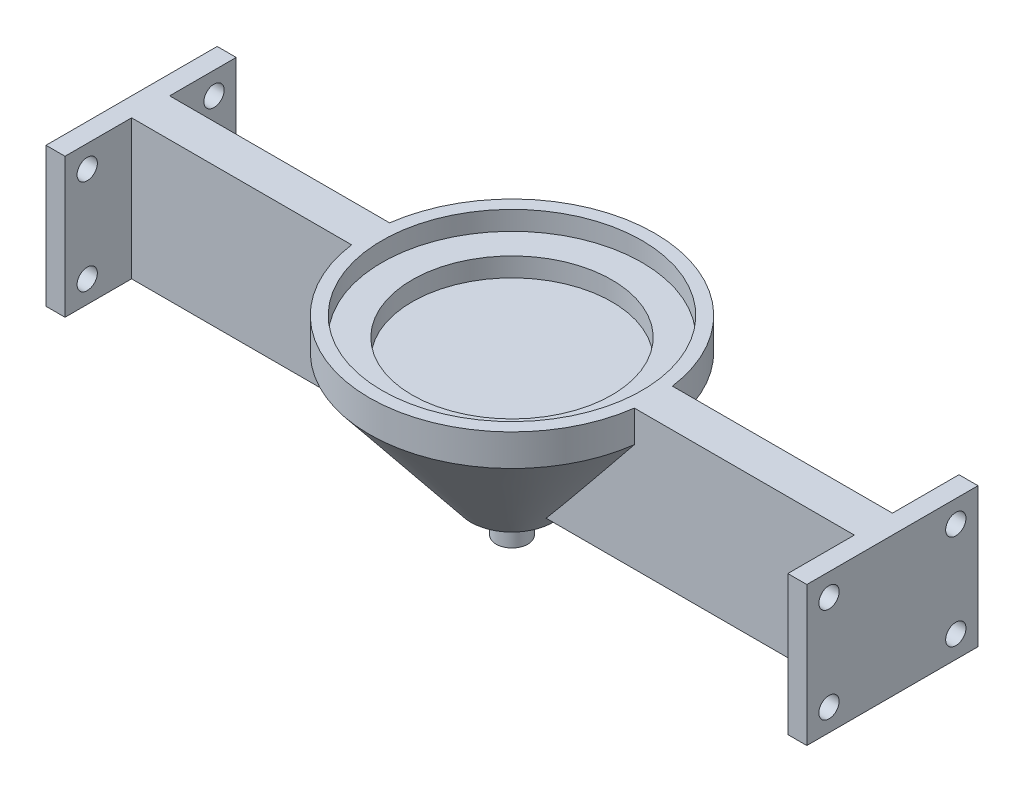
from build123d import *

# Parameters (mm, degrees)
SKETCH1_R    = 22.5
BASE_DEPTH   = 50
SKETCH3_R    = 20.5
INSET_DEPTH  = 3
SKETCH11_R   = 15.75
INSET2_DEPTH = 3
PAD_START    = 60
SKETCH4_W    = 27
SKETCH4_H    = 22
SKETCH4_R    = 1.6
PAD_DEPTH    = 3
RIB_REACH    = 89.901
SKETCH5_W    = 6
SKETCH5_H    = 22
PAD2_START   = -60
SKETCH4_2_W  = 27
SKETCH4_2_H  = 22
SKETCH4_2_R  = 1.6
PAD2_DEPTH   = 3
RIB2_REACH   = 124.863
SKETCH8_W    = 6
SKETCH8_H    = 22


with BuildPart() as part:
    # Sketch1 → Base (new body)
    with BuildSketch(Plane(origin=(0, 0, 0), x_dir=(1, 0, 0), z_dir=(0, 1, 0))):
        Circle(SKETCH1_R)
    extrude(amount=-BASE_DEPTH)

    # Sketch2 → Cone (revolve, cut)
    with BuildSketch(Plane(origin=(0, 0, 0), x_dir=(0, 0, -1), z_dir=(1, 0, 0))):
        Polygon((33.595146004, -5), (33.595146004, -56.971439611), (0, -56.971439611), (0, -30), (2.5, -30), (2.5, -25), (6.5, -25), (22.5, -5), align=None)
    revolve(axis=Axis((0, 0, 0), (0, -1, 0)), mode=Mode.SUBTRACT)

    # Sketch3 → Inset (cut)
    with BuildSketch(Plane(origin=(0, 0, 0), x_dir=(1, 0, 0), z_dir=(0, 1, 0))):
        Circle(SKETCH3_R)
    extrude(amount=-INSET_DEPTH, mode=Mode.SUBTRACT)

    # Sketch11 → Inset2 (cut)
    with BuildSketch(Plane(origin=(0, -3, 0), x_dir=(1, 0, 0), z_dir=(0, 1, 0))):
        Circle(SKETCH11_R)
    extrude(amount=-INSET2_DEPTH, mode=Mode.SUBTRACT)

    # Sketch5 → Rib (add, up to next)
    with BuildSketch(Plane.ZY.offset(-57), mode=Mode.PRIVATE) as rib_sk1:
        with Locations((0, -11)):
            Rectangle(SKETCH5_W, SKETCH5_H)
    rib_tool1 = extrude(rib_sk1.sketch, amount=RIB_REACH, mode=Mode.PRIVATE) - part.part


with BuildPart() as body_2:
    # Sketch4 → Pad (new body)
    with BuildSketch(Plane(origin=(0, 0, 0), x_dir=(0, 0, -1), z_dir=(1, 0, 0)).offset(PAD_START)):
        with Locations((0, -11)):
            Rectangle(SKETCH4_W, SKETCH4_H)
        with Locations((-10, -3.5)):
            Circle(SKETCH4_R, mode=Mode.SUBTRACT)
        with Locations((-10, -18.5)):
            Circle(SKETCH4_R, mode=Mode.SUBTRACT)
        with Locations((10, -18.5)):
            Circle(SKETCH4_R, mode=Mode.SUBTRACT)
        with Locations((10, -3.5)):
            Circle(SKETCH4_R, mode=Mode.SUBTRACT)
    extrude(amount=-PAD_DEPTH)


with BuildPart() as part_1:
    add(part.part)

    add(body_2.part)  # Rib merges body 2
    add(rib_tool1.solids().sort_by_distance((57, -11, 0))[0])

    # Sketch8 → Rib2 (add, up to next)
    with BuildSketch(Plane(origin=(-57, 0, 0), x_dir=(0, 0, -1), z_dir=(1, 0, 0)), mode=Mode.PRIVATE) as rib2_sk1:
        with Locations((0, -11)):
            Rectangle(SKETCH8_W, SKETCH8_H)
    rib2_tool1 = extrude(rib2_sk1.sketch, amount=RIB2_REACH, mode=Mode.PRIVATE) - part_1.part


with BuildPart() as body_2_2:
    # Sketch4<2> → Pad2 (new body)
    with BuildSketch(Plane(origin=(0, 0, 0), x_dir=(0, 0, -1), z_dir=(1, 0, 0)).offset(PAD2_START)):
        with Locations((0, -11)):
            Rectangle(SKETCH4_2_W, SKETCH4_2_H)
        with Locations((-10, -3.5)):
            Circle(SKETCH4_2_R, mode=Mode.SUBTRACT)
        with Locations((-10, -18.5)):
            Circle(SKETCH4_2_R, mode=Mode.SUBTRACT)
        with Locations((10, -18.5)):
            Circle(SKETCH4_2_R, mode=Mode.SUBTRACT)
        with Locations((10, -3.5)):
            Circle(SKETCH4_2_R, mode=Mode.SUBTRACT)
    extrude(amount=PAD2_DEPTH)


with BuildPart() as part_2:
    add(part_1.part)

    add(body_2_2.part)  # Rib2 merges body 2 2
    add(rib2_tool1.solids().sort_by_distance((-57, -11, 0))[0])


solid = part_2.part
